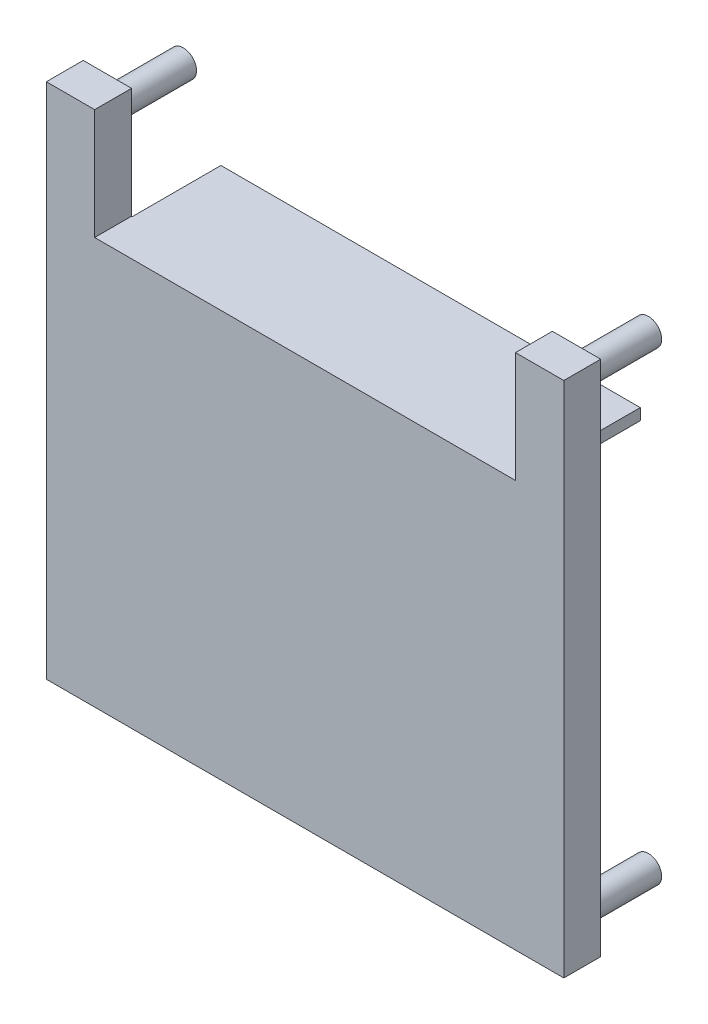
from build123d import *

# Parameters (mm, degrees)
SKETCH_1_W          = 70.09
SKETCH_1_H          = 70.09
EXTRUDE_1_DEPTH     = 5
SKETCH_2_R          = 1.8
EXTRUDE_2_DEPTH     = 10
SKETCH_4_W          = 57
SKETCH_4_H          = 5
CUT_EXTRUDE_2_DEPTH = 15
SKETCH_5_W          = 56.8
SKETCH_5_H          = 1.545
EXTRUDE_3_DEPTH     = 12
SKETCH_6_W          = 6
SKETCH_6_H          = 18
EXTRUDE_4_DEPTH     = 3.7
SKETCH_7_W          = 15
SKETCH_7_H          = 20
EXTRUDE_5_DEPTH     = 2


with BuildPart() as part:
    # 草图1 → 凸台-拉伸1 (new body)
    with BuildSketch(Plane.XY):
        Rectangle(SKETCH_1_W, SKETCH_1_H)
    extrude(amount=EXTRUDE_1_DEPTH)

    # 草图2 → 凸台-拉伸2 (add)
    with BuildSketch(Plane.XY):
        with Locations((31.5, 31.5)):
            Circle(SKETCH_2_R)
        with Locations((31.5, -31.5)):
            Circle(SKETCH_2_R)
        with Locations((-31.5, -31.5)):
            Circle(SKETCH_2_R)
        with Locations((-31.5, 31.5)):
            Circle(SKETCH_2_R)
    extrude(amount=-EXTRUDE_2_DEPTH)

    # 草图4 → 切除-拉伸2 (cut)
    with BuildSketch(Plane(origin=(0, 35.045, 0), x_dir=(1, 0, 0), z_dir=(0, 1, 0))):
        with Locations((0, -2.5)):
            Rectangle(SKETCH_4_W, SKETCH_4_H)
    extrude(amount=-CUT_EXTRUDE_2_DEPTH, mode=Mode.SUBTRACT)

    # 草图5 → 凸台-拉伸3 (add)
    with BuildSketch(Plane(origin=(0, 0, 0), x_dir=(-1, 0, 0), z_dir=(0, 0, -1))):
        with Locations((0, 19.2725)):
            Rectangle(SKETCH_5_W, SKETCH_5_H)
    extrude(amount=EXTRUDE_3_DEPTH)

    # 草图6 → 凸台-拉伸4 (add)
    with BuildSketch(Plane(origin=(0, 0, 0), x_dir=(-1, 0, 0), z_dir=(0, 0, -1))):
        with Locations((-19.5, 9.5)):
            Rectangle(SKETCH_6_W, SKETCH_6_H)
    extrude(amount=EXTRUDE_4_DEPTH)

    # 草图7 → 凸台-拉伸5 (add)
    with BuildSketch(Plane(origin=(0, 0, 0), x_dir=(-1, 0, 0), z_dir=(0, 0, -1))):
        with Locations((15.5, 8.5)):
            Rectangle(SKETCH_7_W, SKETCH_7_H)
    extrude(amount=EXTRUDE_5_DEPTH)


solid = part.part
